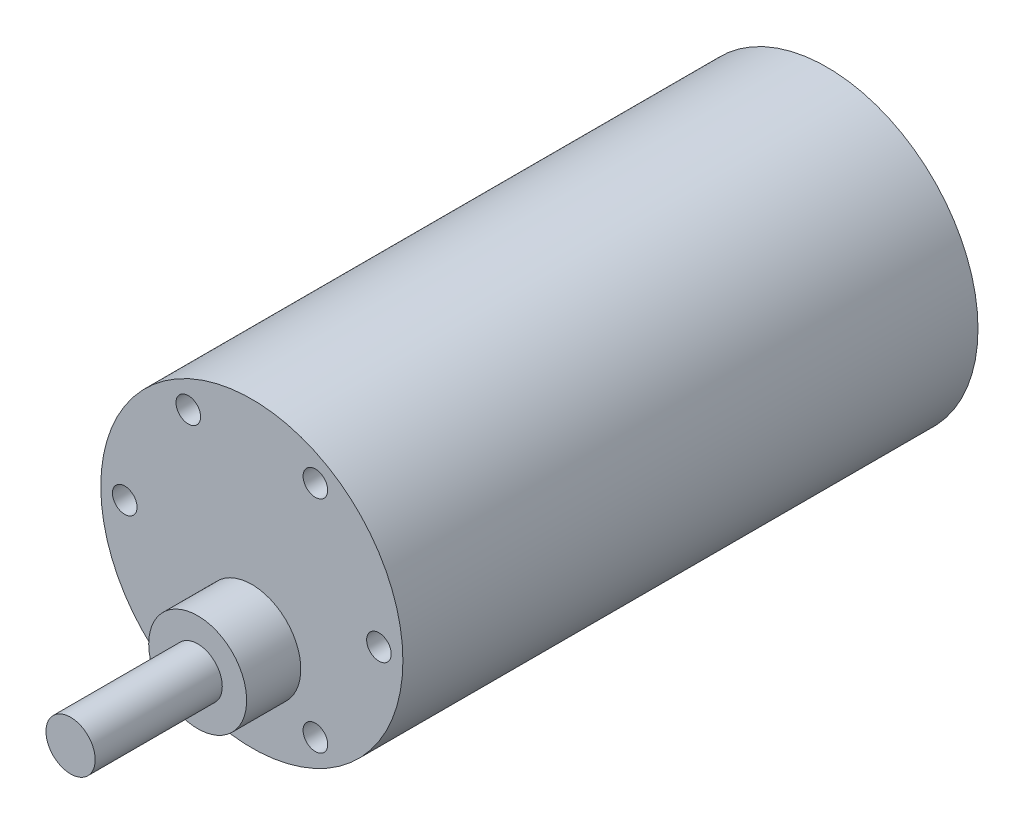
from build123d import *

# Parameters (mm, degrees)
SKETCH1_R           = 18.415
BOSS_EXTRUDE1_DEPTH = 70.104
SKETCH2_R           = 5.969
BOSS_EXTRUDE2_DEPTH = 6.604
SKETCH3_R           = 3
BOSS_EXTRUDE3_DEPTH = 15.494
SKETCH4_R           = 1.5
CUT_EXTRUDE1_DEPTH  = 25.4


with BuildPart() as part:
    # Sketch1 → Boss-Extrude1 (new body)
    with BuildSketch(Plane.XY):
        Circle(SKETCH1_R)
    extrude(amount=BOSS_EXTRUDE1_DEPTH)

    # Sketch2 → Boss-Extrude2 (add)
    with BuildSketch(Plane.XY.offset(70.104)):
        with Locations(Location((0, -7.112, 0), (0, 0, 180))):
            Circle(SKETCH2_R)
    extrude(amount=BOSS_EXTRUDE2_DEPTH)

    # Sketch3 → Boss-Extrude3 (add)
    with BuildSketch(Plane.XY.offset(76.708)):
        with Locations((0, -7.112)):
            Circle(SKETCH3_R)
    extrude(amount=BOSS_EXTRUDE3_DEPTH)

    # Sketch4 → Cut-Extrude1 (cut)
    with BuildSketch(Plane.XY.offset(70.104)):
        with Locations((-15.494, 0)):
            Circle(SKETCH4_R)
        with Locations((15.494, 0)):
            Circle(SKETCH4_R)
        with Locations((7.747, 13.418197606)):
            Circle(SKETCH4_R)
        with Locations((-7.747, 13.418197606)):
            Circle(SKETCH4_R)
        with Locations((-7.747, -13.418197606)):
            Circle(SKETCH4_R)
        with Locations((7.747, -13.418197606)):
            Circle(SKETCH4_R)
    extrude(amount=-CUT_EXTRUDE1_DEPTH, mode=Mode.SUBTRACT)


solid = part.part
